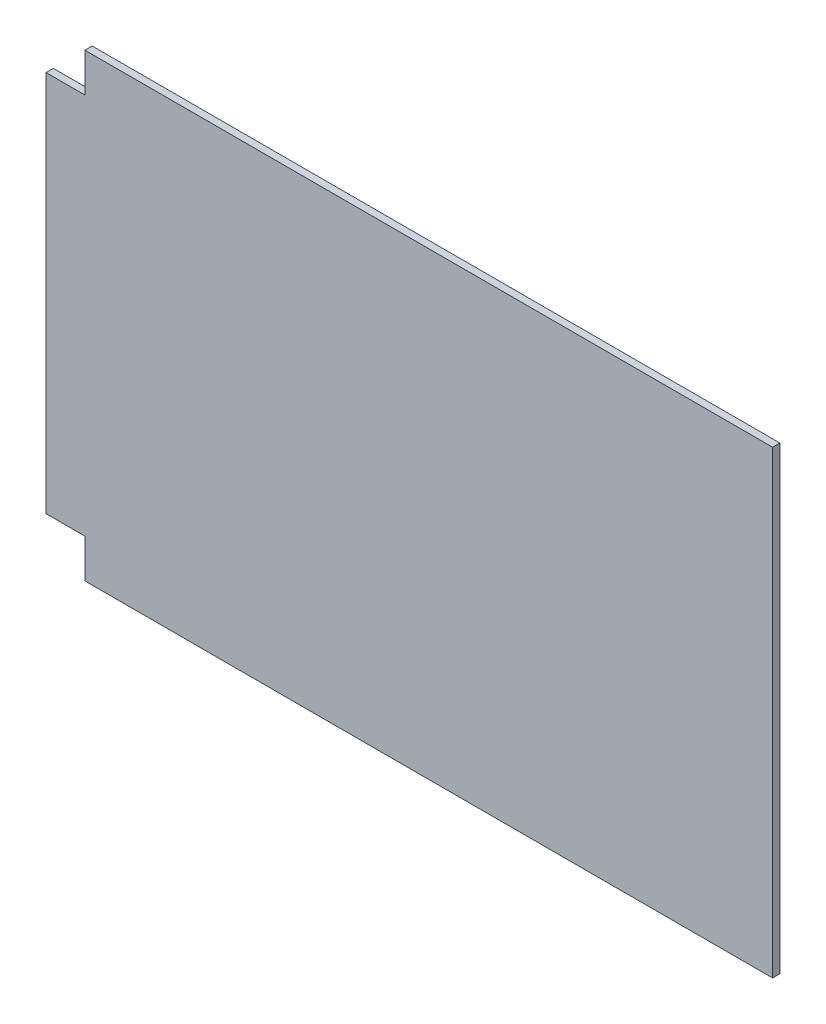
from build123d import *

# Parameters (mm, degrees)
SKETCH_1_W          = 500.8
SKETCH_1_H          = 300.8
EXTRUDE_1_DEPTH     = 4.75
SKETCH_2_W          = 25.4
SKETCH_2_H          = 25.4
CUT_EXTRUDE_1_DEPTH = 10


with BuildPart() as part:
    # 草圖1 → 填料-伸長1 (new body)
    with BuildSketch(Plane.XY):
        Rectangle(SKETCH_1_W, SKETCH_1_H)
    extrude(amount=EXTRUDE_1_DEPTH)

    # 草圖2 → 除料-伸長1 (cut)
    with BuildSketch(Plane(origin=(0, 0, 0), x_dir=(-1, 0, 0), z_dir=(0, 0, -1))):
        Polygon((-250.4, 150.4), (-225, 150.4), (-225, 125), (-225, -125), (-225, -150.4), (-250.4, -150.4), (-250.4, -125), (-250.4, 125), align=None)
        with Locations((237.7, 137.7)):
            Rectangle(SKETCH_2_W, SKETCH_2_H)
        with Locations((237.7, -137.7)):
            Rectangle(SKETCH_2_W, SKETCH_2_H)
    extrude(amount=-CUT_EXTRUDE_1_DEPTH, mode=Mode.SUBTRACT)


solid = part.part
